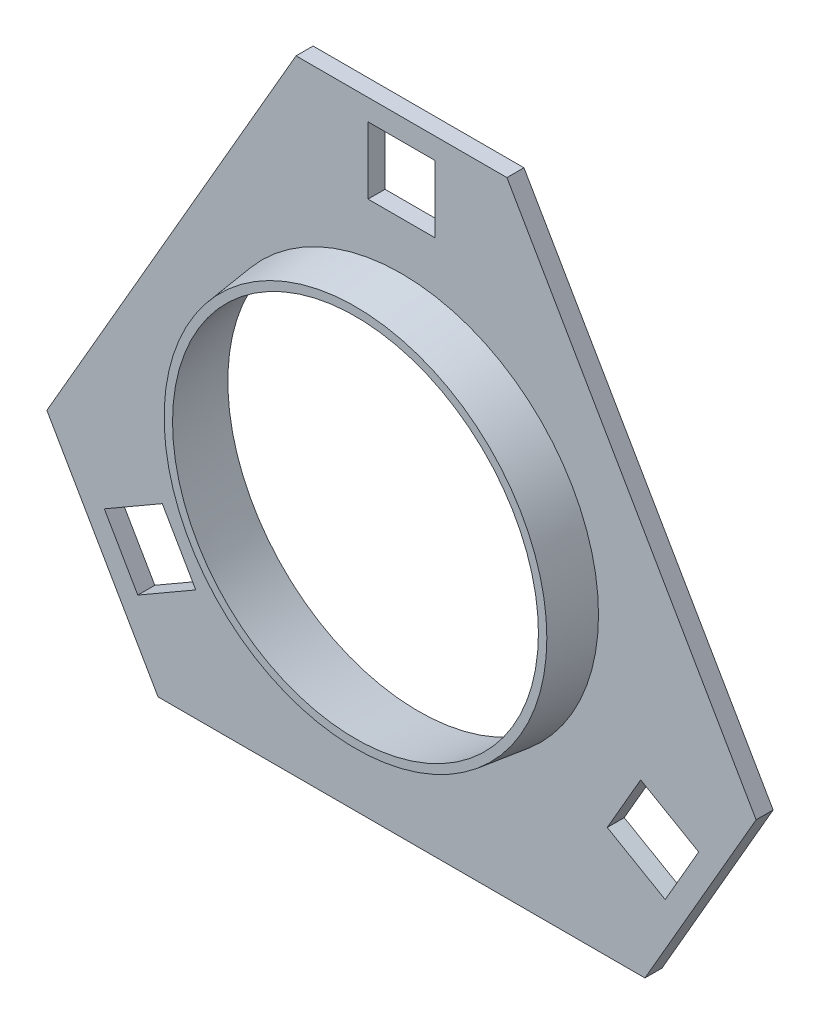
from build123d import *

# Parameters (mm, degrees)
SKETCH1_W           = 8.73
SKETCH1_H           = 8.73
BOSS_EXTRUDE1_DEPTH = 2.22
SKETCH2_R           = 25.695
BOSS_EXTRUDE2_DEPTH = 6
BOSS_EXTRUDE2_TAPER = 7
SKETCH3_R           = 23.86
CUT_EXTRUDE1_DEPTH  = 8.22
CUT_EXTRUDE1_DRAFT  = 7


with BuildPart() as part:
    # Sketch1 → Boss-Extrude1 (new body)
    with BuildSketch(Plane.XY):
        Polygon((-31.75, 0), (31.75, 0), (46.25, 25.11473671), (13.75, 81.406387956), (-13.75, 81.406387956), (-46.25, 25.11473671), align=None)
        Polygon((-34.392628869, 10.177167467), (-38.757628869, 17.737569242), (-31.197227094, 22.102569242), (-26.832227094, 14.542167467), align=None, mode=Mode.SUBTRACT)
        with Locations((0, 74.281387956)):
            Rectangle(SKETCH1_W, SKETCH1_H, mode=Mode.SUBTRACT)
        Polygon((34.392628869, 10.177167467), (38.757628869, 17.737569242), (31.197227094, 22.102569242), (26.832227094, 14.542167467), align=None, mode=Mode.SUBTRACT)
    extrude(amount=BOSS_EXTRUDE1_DEPTH)

    # Sketch2 → Boss-Extrude2 (add)
    with BuildSketch(Plane.XY.offset(2.22)):
        with Locations((0, 38)):
            Circle(SKETCH2_R)
    extrude(amount=BOSS_EXTRUDE2_DEPTH, taper=BOSS_EXTRUDE2_TAPER)


with BuildPart() as cut_extrude1_tool:
    # Sketch3 → Cut-Extrude1 (with draft: the straight prism first)
    with BuildSketch(Plane.XY.offset(8.22)):
        with Locations((0, 38)):
            Circle(SKETCH3_R)
    extrude(amount=-CUT_EXTRUDE1_DEPTH)
    # Cut-Extrude1: the draft: its side faces are tilted about the plane it starts from
    cut_extrude1_sides = [cut_extrude1_tool.faces().sort_by_distance(p)[0] for p in [
        (-23.86, 38, 4.11),
    ]]
    draft(cut_extrude1_sides, Plane.XY.offset(8.22), CUT_EXTRUDE1_DRAFT)


with BuildPart() as part_1:
    add(part.part)

    # Cut-Extrude1: cut by cut_extrude1_tool
    add(cut_extrude1_tool.part, mode=Mode.SUBTRACT)


solid = part_1.part
